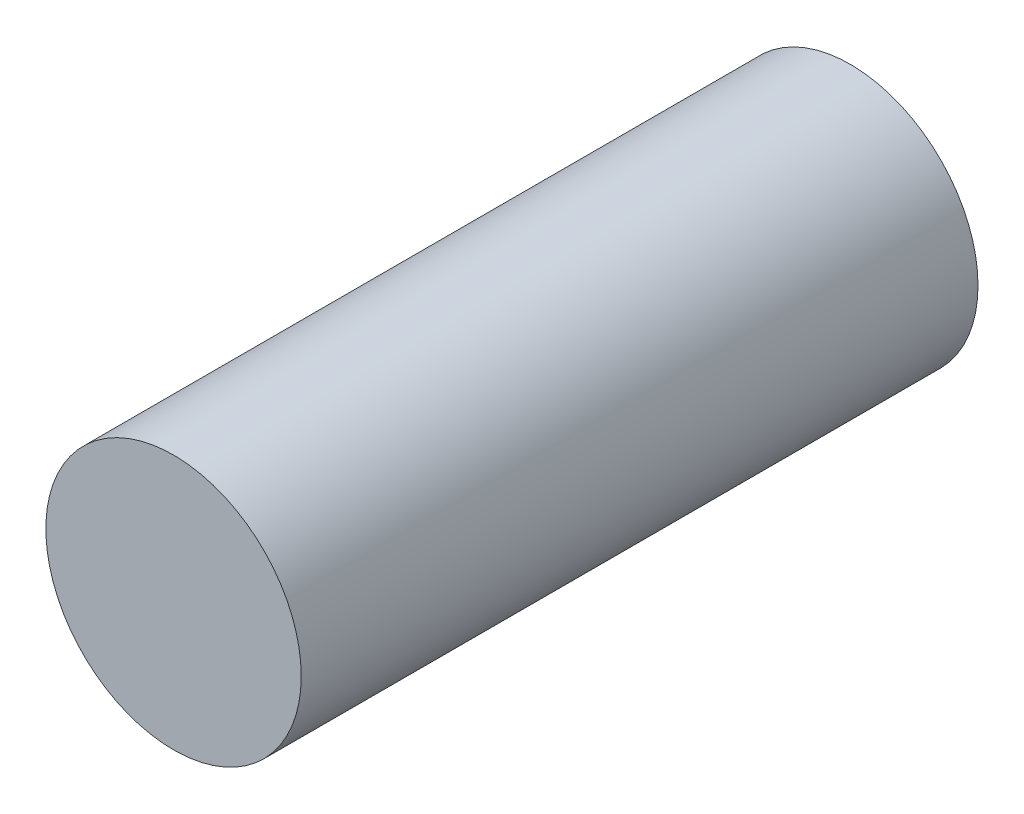
from build123d import *

# Parameters (mm, degrees)
SKETCH2_R           = 50
BOSS_EXTRUDE1_DEPTH = 265


with BuildPart() as part:
    # Sketch2 → Boss-Extrude1 (new body)
    with BuildSketch(Plane.XY):
        Circle(SKETCH2_R)
    extrude(amount=BOSS_EXTRUDE1_DEPTH)


solid = part.part
